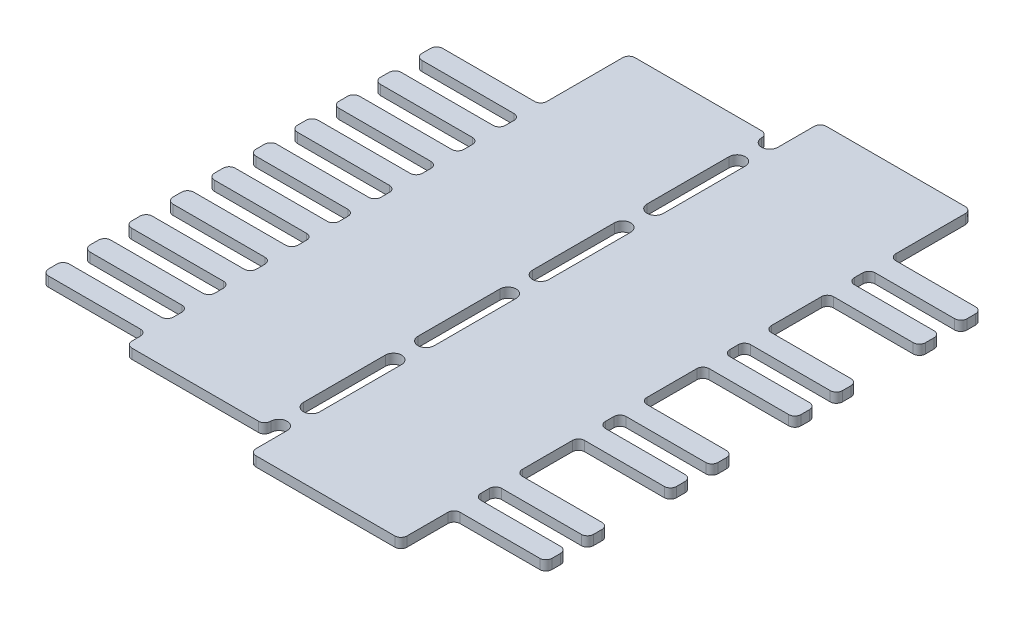
from build123d import *

# Parameters (mm, degrees)
BOSS_EXTRUDE1_DEPTH   = 1.2
CUT_EXTRUDE1_DEPTH    = 87.047243419
BODY_MOVE_COPY1_ANGLE = 180


with BuildPart() as part:
    # Sketch1 → Boss-Extrude1 (new body)
    with BuildSketch(Plane(origin=(0, 0, 0), x_dir=(1, 0, 0), z_dir=(0, 1, 0))):
        with BuildLine():
            Line((-0.75, 10), (-10.5, 10))
            ThreePointArc((-10.5, 10), (-11.030330086, 10.219669914), (-11.25, 10.75))
            Line((-11.25, 10.75), (-11.25, 11.79))
            ThreePointArc((-11.25, 11.79), (-11.030330086, 12.320330086), (-10.5, 12.54))
            Line((-10.5, 12.54), (-0.75, 12.54))
            ThreePointArc((-0.75, 12.54), (-0.219669914, 12.759669914), (0, 13.29))
            Line((0, 13.29), (0, 14.33))
            ThreePointArc((0, 14.33), (-0.219669914, 14.860330086), (-0.75, 15.08))
            Line((-0.75, 15.08), (-10.5, 15.08))
            ThreePointArc((-10.5, 15.08), (-11.030330086, 15.299669914), (-11.25, 15.83))
            Line((-11.25, 15.83), (-11.25, 16.87))
            ThreePointArc((-11.25, 16.87), (-11.030330086, 17.400330086), (-10.5, 17.62))
            Line((-10.5, 17.62), (-0.75, 17.62))
            ThreePointArc((-0.75, 17.62), (-0.219669914, 17.839669914), (0, 18.37))
            Line((0, 18.37), (0, 24.49))
            ThreePointArc((0, 24.49), (-0.219669914, 25.020330086), (-0.75, 25.24))
            Line((-0.75, 25.24), (-10.5, 25.24))
            ThreePointArc((-10.5, 25.24), (-11.030330086, 25.459669914), (-11.25, 25.99))
            Line((-11.25, 25.99), (-11.25, 27.03))
            ThreePointArc((-11.25, 27.03), (-11.030330086, 27.560330086), (-10.5, 27.78))
            Line((-10.5, 27.78), (-0.75, 27.78))
            ThreePointArc((-0.75, 27.78), (-0.219669914, 27.999669914), (0, 28.53))
            Line((0, 28.53), (0, 29.57))
            ThreePointArc((0, 29.57), (-0.219669914, 30.100330086), (-0.75, 30.32))
            Line((-0.75, 30.32), (-10.5, 30.32))
            ThreePointArc((-10.5, 30.32), (-11.030330086, 30.539669914), (-11.25, 31.07))
            Line((-11.25, 31.07), (-11.25, 32.11))
            ThreePointArc((-11.25, 32.11), (-11.030330086, 32.640330086), (-10.5, 32.86))
            Line((-10.5, 32.86), (-0.75, 32.86))
            ThreePointArc((-0.75, 32.86), (-0.219669914, 33.079669914), (0, 33.61))
            Line((0, 33.61), (0, 39.73))
            ThreePointArc((0, 39.73), (-0.219669914, 40.260330086), (-0.75, 40.48))
            Line((-0.75, 40.48), (-10.5, 40.48))
            ThreePointArc((-10.5, 40.48), (-11.030330086, 40.699669914), (-11.25, 41.23))
            Line((-11.25, 41.23), (-11.25, 42.27))
            ThreePointArc((-11.25, 42.27), (-11.030330086, 42.800330086), (-10.5, 43.02))
            Line((-10.5, 43.02), (-0.75, 43.02))
            ThreePointArc((-0.75, 43.02), (-0.219669914, 43.239669914), (0, 43.77))
            Line((0, 43.77), (0, 44.81))
            ThreePointArc((0, 44.81), (-0.219669914, 45.340330086), (-0.75, 45.56))
            Line((-0.75, 45.56), (-10.5, 45.56))
            ThreePointArc((-10.5, 45.56), (-11.030330086, 45.779669914), (-11.25, 46.31))
            Line((-11.25, 46.31), (-11.25, 47.35))
            ThreePointArc((-11.25, 47.35), (-11.030330086, 47.880330086), (-10.5, 48.1))
            Line((-10.5, 48.1), (-0.75, 48.1))
            ThreePointArc((-0.75, 48.1), (-0.219669914, 48.319669914), (0, 48.85))
            Line((0, 48.85), (0, 54.97))
            ThreePointArc((0, 54.97), (-0.219669914, 55.500330086), (-0.75, 55.72))
            Line((-0.75, 55.72), (-10.5, 55.72))
            ThreePointArc((-10.5, 55.72), (-11.030330086, 55.939669914), (-11.25, 56.47))
            Line((-11.25, 56.47), (-11.25, 57.51))
            ThreePointArc((-11.25, 57.51), (-11.030330086, 58.040330086), (-10.5, 58.26))
            Line((-10.5, 58.26), (-0.75, 58.26))
            ThreePointArc((-0.75, 58.26), (-0.219669914, 58.479669914), (0, 59.01))
            Line((0, 59.01), (0, 60.05))
            ThreePointArc((0, 60.05), (-0.219669914, 60.580330086), (-0.75, 60.8))
            Line((-0.75, 60.8), (-10.5, 60.8))
            ThreePointArc((-10.5, 60.8), (-11.030330086, 61.019669914), (-11.25, 61.55))
            Line((-11.25, 61.55), (-11.25, 62.59))
            ThreePointArc((-11.25, 62.59), (-11.030330086, 63.120330086), (-10.5, 63.34))
            Line((-10.5, 63.34), (-0.75, 63.34))
            ThreePointArc((-0.75, 63.34), (-0.219669914, 63.559669914), (0, 64.09))
            Line((0, 64.09), (0, 69.09))
            ThreePointArc((0, 69.09), (0.219669914, 69.620330086), (0.75, 69.84))
            Line((0.75, 69.84), (17.75, 69.84))
            ThreePointArc((17.75, 69.84), (18.280330086, 69.620330086), (18.5, 69.09))
            Line((18.5, 69.09), (18.5, 65.27050991))
            ThreePointArc((18.5, 65.27050991), (19.5, 64.27050991), (20.5, 65.27050991))
            ThreePointArc((20.5, 65.27050991), (20.719669914, 65.800839996), (21.25, 66.02050991))
            Line((21.25, 66.02050991), (36.75, 66.02050991))
            ThreePointArc((36.75, 66.02050991), (37.280330086, 65.800839996), (37.5, 65.27050991))
            Line((37.5, 65.27050991), (37.5, 64.23050991))
            ThreePointArc((37.5, 64.23050991), (37.719669914, 63.700179824), (38.25, 63.48050991))
            Line((38.25, 63.48050991), (49.5, 63.48050991))
            ThreePointArc((49.5, 63.48050991), (50.030330086, 63.260839996), (50.25, 62.73050991))
            Line((50.25, 62.73050991), (50.25, 61.69050991))
            ThreePointArc((50.25, 61.69050991), (50.030330086, 61.160179824), (49.5, 60.94050991))
            Line((49.5, 60.94050991), (38.25, 60.94050991))
            ThreePointArc((38.25, 60.94050991), (37.719669914, 60.720839996), (37.5, 60.19050991))
            Line((37.5, 60.19050991), (37.5, 59.15050991))
            ThreePointArc((37.5, 59.15050991), (37.719669914, 58.620179824), (38.25, 58.40050991))
            Line((38.25, 58.40050991), (49.5, 58.40050991))
            ThreePointArc((49.5, 58.40050991), (50.030330086, 58.180839996), (50.25, 57.65050991))
            Line((50.25, 57.65050991), (50.25, 56.61050991))
            ThreePointArc((50.25, 56.61050991), (50.030330086, 56.080179824), (49.5, 55.86050991))
            Line((49.5, 55.86050991), (38.25, 55.86050991))
            ThreePointArc((38.25, 55.86050991), (37.719669914, 55.640839996), (37.5, 55.11050991))
            Line((37.5, 55.11050991), (37.5, 54.07050991))
            ThreePointArc((37.5, 54.07050991), (37.719669914, 53.540179824), (38.25, 53.32050991))
            Line((38.25, 53.32050991), (49.5, 53.32050991))
            ThreePointArc((49.5, 53.32050991), (50.030330086, 53.100839996), (50.25, 52.57050991))
            Line((50.25, 52.57050991), (50.25, 51.53050991))
            ThreePointArc((50.25, 51.53050991), (50.030330086, 51.000179824), (49.5, 50.78050991))
            Line((49.5, 50.78050991), (38.25, 50.78050991))
            ThreePointArc((38.25, 50.78050991), (37.719669914, 50.560839996), (37.5, 50.03050991))
            Line((37.5, 50.03050991), (37.5, 48.99050991))
            ThreePointArc((37.5, 48.99050991), (37.719669914, 48.460179824), (38.25, 48.24050991))
            Line((38.25, 48.24050991), (49.5, 48.24050991))
            ThreePointArc((49.5, 48.24050991), (50.030330086, 48.020839996), (50.25, 47.49050991))
            Line((50.25, 47.49050991), (50.25, 46.45050991))
            ThreePointArc((50.25, 46.45050991), (50.030330086, 45.920179824), (49.5, 45.70050991))
            Line((49.5, 45.70050991), (38.25, 45.70050991))
            ThreePointArc((38.25, 45.70050991), (37.719669914, 45.480839996), (37.5, 44.95050991))
            Line((37.5, 44.95050991), (37.5, 43.91050991))
            ThreePointArc((37.5, 43.91050991), (37.719669914, 43.380179824), (38.25, 43.16050991))
            Line((38.25, 43.16050991), (49.5, 43.16050991))
            ThreePointArc((49.5, 43.16050991), (50.030330086, 42.940839996), (50.25, 42.41050991))
            Line((50.25, 42.41050991), (50.25, 41.37050991))
            ThreePointArc((50.25, 41.37050991), (50.030330086, 40.840179824), (49.5, 40.62050991))
            Line((49.5, 40.62050991), (38.25, 40.62050991))
            ThreePointArc((38.25, 40.62050991), (37.719669914, 40.400839996), (37.5, 39.87050991))
            Line((37.5, 39.87050991), (37.5, 38.83050991))
            ThreePointArc((37.5, 38.83050991), (37.719669914, 38.300179824), (38.25, 38.08050991))
            Line((38.25, 38.08050991), (49.5, 38.08050991))
            ThreePointArc((49.5, 38.08050991), (50.030330086, 37.860839996), (50.25, 37.33050991))
            Line((50.25, 37.33050991), (50.25, 36.29050991))
            ThreePointArc((50.25, 36.29050991), (50.030330086, 35.760179824), (49.5, 35.54050991))
            Line((49.5, 35.54050991), (38.25, 35.54050991))
            ThreePointArc((38.25, 35.54050991), (37.719669914, 35.320839996), (37.5, 34.79050991))
            Line((37.5, 34.79050991), (37.5, 33.75050991))
            ThreePointArc((37.5, 33.75050991), (37.719669914, 33.220179824), (38.25, 33.00050991))
            Line((38.25, 33.00050991), (49.5, 33.00050991))
            ThreePointArc((49.5, 33.00050991), (50.030330086, 32.780839996), (50.25, 32.25050991))
            Line((50.25, 32.25050991), (50.25, 31.21050991))
            ThreePointArc((50.25, 31.21050991), (50.030330086, 30.680179824), (49.5, 30.46050991))
            Line((49.5, 30.46050991), (38.25, 30.46050991))
            ThreePointArc((38.25, 30.46050991), (37.719669914, 30.240839996), (37.5, 29.71050991))
            Line((37.5, 29.71050991), (37.5, 28.67050991))
            ThreePointArc((37.5, 28.67050991), (37.719669914, 28.140179824), (38.25, 27.92050991))
            Line((38.25, 27.92050991), (49.5, 27.92050991))
            ThreePointArc((49.5, 27.92050991), (50.030330086, 27.700839996), (50.25, 27.17050991))
            Line((50.25, 27.17050991), (50.25, 26.13050991))
            ThreePointArc((50.25, 26.13050991), (50.030330086, 25.600179824), (49.5, 25.38050991))
            Line((49.5, 25.38050991), (38.25, 25.38050991))
            ThreePointArc((38.25, 25.38050991), (37.719669914, 25.160839996), (37.5, 24.63050991))
            Line((37.5, 24.63050991), (37.5, 23.59050991))
            ThreePointArc((37.5, 23.59050991), (37.719669914, 23.060179824), (38.25, 22.84050991))
            Line((38.25, 22.84050991), (49.5, 22.84050991))
            ThreePointArc((49.5, 22.84050991), (50.030330086, 22.620839996), (50.25, 22.09050991))
            Line((50.25, 22.09050991), (50.25, 21.05050991))
            ThreePointArc((50.25, 21.05050991), (50.030330086, 20.520179824), (49.5, 20.30050991))
            Line((49.5, 20.30050991), (38.25, 20.30050991))
            ThreePointArc((38.25, 20.30050991), (37.719669914, 20.080839996), (37.5, 19.55050991))
            Line((37.5, 19.55050991), (37.5, 18.51050991))
            ThreePointArc((37.5, 18.51050991), (37.719669914, 17.980179824), (38.25, 17.76050991))
            Line((38.25, 17.76050991), (49.5, 17.76050991))
            ThreePointArc((49.5, 17.76050991), (50.030330086, 17.540839996), (50.25, 17.01050991))
            Line((50.25, 17.01050991), (50.25, 15.97050991))
            ThreePointArc((50.25, 15.97050991), (50.030330086, 15.440179824), (49.5, 15.22050991))
            Line((49.5, 15.22050991), (38.25, 15.22050991))
            ThreePointArc((38.25, 15.22050991), (37.719669914, 15.000839996), (37.5, 14.47050991))
            Line((37.5, 14.47050991), (37.5, 5.18300671))
            ThreePointArc((37.5, 5.18300671), (37.280330086, 4.652676624), (36.75, 4.43300671))
            Line((36.75, 4.43300671), (21.25, 4.43300671))
            ThreePointArc((21.25, 4.43300671), (20.719669914, 4.652676624), (20.5, 5.18300671))
            ThreePointArc((20.5, 5.18300671), (19.5, 6.18300671), (18.5, 5.18300671))
            Line((18.5, 5.18300671), (18.5, 0.75))
            ThreePointArc((18.5, 0.75), (18.280330086, 0.219669914), (17.75, 0))
            Line((17.75, 0), (0.75, 0))
            ThreePointArc((0.75, 0), (0.219669914, 0.219669914), (0, 0.75))
            Line((0, 0.75), (0, 9.25))
            ThreePointArc((0, 9.25), (-0.219669914, 9.780330086), (-0.75, 10))
        make_face()
    extrude(amount=BOSS_EXTRUDE1_DEPTH)

    # Sketch2 → Cut-Extrude1 (cut, through all)
    with BuildSketch(Plane.XZ):
        with BuildLine():
            Line((18.5, -61.27050991), (18.5, -51.25050991))
            ThreePointArc((18.5, -51.25050991), (19.5, -50.25050991), (20.5, -51.25050991))
            Line((20.5, -51.25050991), (20.5, -61.27050991))
            ThreePointArc((20.5, -61.27050991), (19.5, -62.27050991), (18.5, -61.27050991))
        make_face()
        with BuildLine():
            Line((18.5, -47.25050991), (18.5, -37.23050991))
            ThreePointArc((18.5, -37.23050991), (19.5, -36.23050991), (20.5, -37.23050991))
            Line((20.5, -37.23050991), (20.5, -47.25050991))
            ThreePointArc((20.5, -47.25050991), (19.5, -48.25050991), (18.5, -47.25050991))
        make_face()
        with BuildLine():
            Line((18.5, -23.20300671), (18.5, -33.22300671))
            ThreePointArc((18.5, -33.22300671), (19.5, -34.22300671), (20.5, -33.22300671))
            Line((20.5, -33.22300671), (20.5, -23.20300671))
            ThreePointArc((20.5, -23.20300671), (19.5, -22.20300671), (18.5, -23.20300671))
        make_face()
        with BuildLine():
            Line((18.5, -9.18300671), (18.5, -19.20300671))
            ThreePointArc((18.5, -19.20300671), (19.5, -20.20300671), (20.5, -19.20300671))
            Line((20.5, -19.20300671), (20.5, -9.18300671))
            ThreePointArc((20.5, -9.18300671), (19.5, -8.18300671), (18.5, -9.18300671))
        make_face()
    extrude(amount=-CUT_EXTRUDE1_DEPTH, mode=Mode.SUBTRACT)


with BuildPart() as part_1:
    # Body-Move/Copy1: moved
    add(part.part.rotate(Axis((17.625, 0, -34.92), (0, 1, 0)), BODY_MOVE_COPY1_ANGLE))


solid = part_1.part
